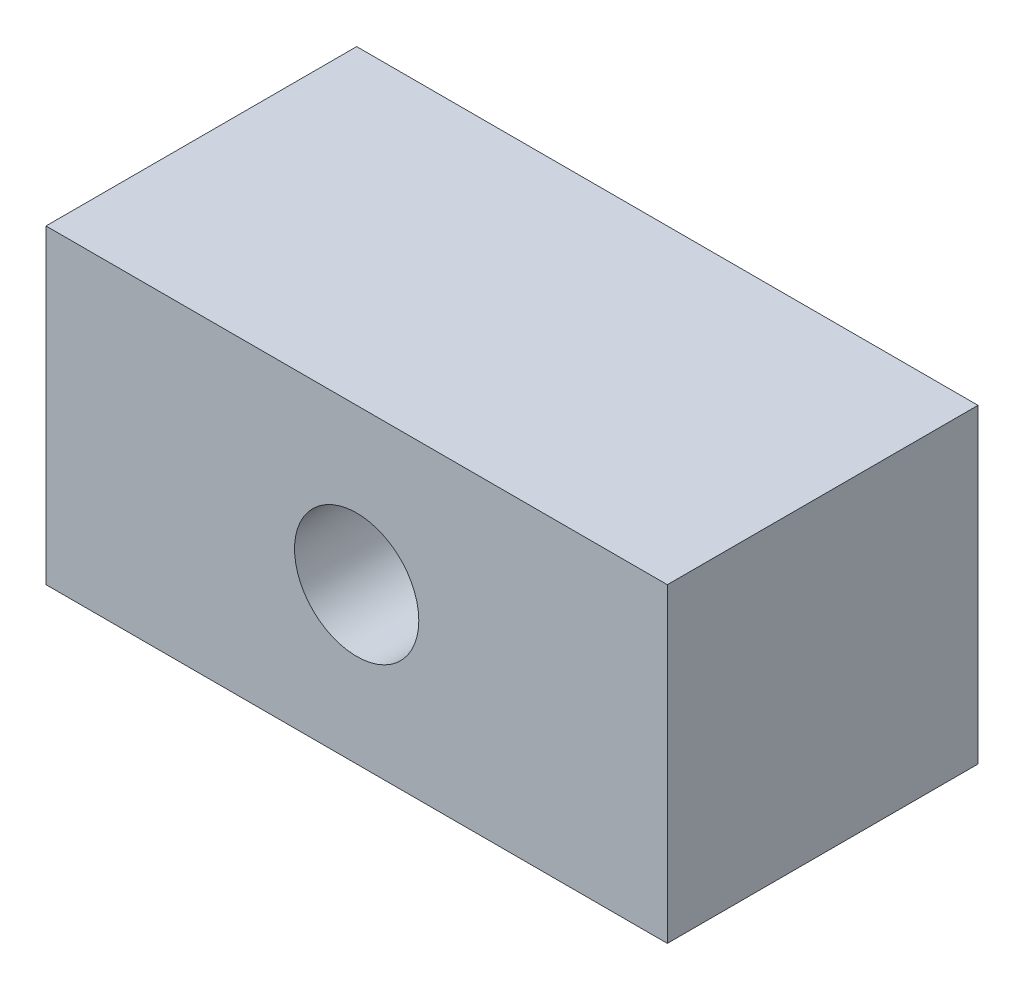
from build123d import *

# Parameters (mm, degrees)
ESBO_O1_W                = 40
ESBO_O1_H                = 20
RESSALTO_EXTRUS_O1_DEPTH = 20
ESBO_O2_R                = 4
CORTE_EXTRUS_O1_DEPTH    = 20


with BuildPart() as part:
    # Esboço1 → Ressalto-extrusão1 (new body)
    with BuildSketch(Plane(origin=(0, 0, 0), x_dir=(1, 0, 0), z_dir=(0, 1, 0))):
        with Locations((-0.961538462, -5.480769231)):
            Rectangle(ESBO_O1_W, ESBO_O1_H)
    extrude(amount=RESSALTO_EXTRUS_O1_DEPTH)

    # Esboço2 → Corte-extrusão1 (cut)
    with BuildSketch(Plane.XY.offset(15.480769231)):
        with Locations((-0.961538462, 10)):
            Circle(ESBO_O2_R)
    extrude(amount=-CORTE_EXTRUS_O1_DEPTH, mode=Mode.SUBTRACT)


solid = part.part
